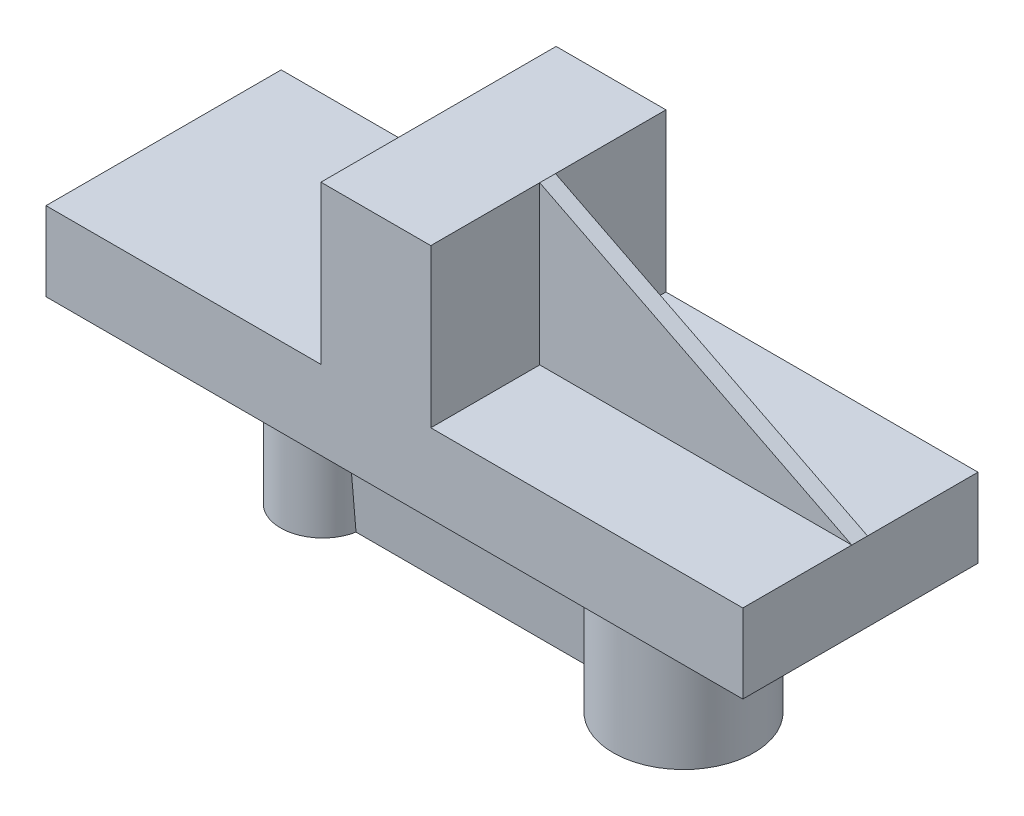
from build123d import *

# Parameters (mm, degrees)
SKETCH1_W           = 88.323262869
SKETCH1_H           = 29.809101218
BOSS_EXTRUDE1_DEPTH = 10
SKETCH2_W           = 13.924014339
SKETCH2_H           = 29.809101218
BOSS_EXTRUDE2_DEPTH = 20
RIB1_REACH          = 96.478
SKETCH4_WALL_W      = 235.275808006
SKETCH4_WALL_H      = 2
SKETCH5_R           = 5.326775894
SKETCH5_R_2         = 8.926735981
BOSS_EXTRUDE3_DEPTH = 20
RIB2_REACH          = 96.478
SKETCH6_WALL_W      = 222.44376487
SKETCH6_WALL_H      = 2
RIB2_DRAFT_ANGLE    = 4


with BuildPart() as part:
    # Sketch1 → Boss-Extrude1 (new body)
    with BuildSketch(Plane(origin=(0, 0, 0), x_dir=(1, 0, 0), z_dir=(0, 1, 0))):
        with Locations((44.161631435, -14.904550609)):
            Rectangle(SKETCH1_W, SKETCH1_H)
    extrude(amount=BOSS_EXTRUDE1_DEPTH)

    # Sketch2 → Boss-Extrude2 (add)
    with BuildSketch(Plane(origin=(0, 10, 0), x_dir=(1, 0, 0), z_dir=(0, 1, 0))):
        with Locations((41.809601986, -14.904550609)):
            Rectangle(SKETCH2_W, SKETCH2_H)
    extrude(amount=BOSS_EXTRUDE2_DEPTH)

    # Sketch4 wall → Rib1 (add, up to next)
    with BuildSketch(Plane(origin=(68.547436012, 20, 15), x_dir=(0.892394851297, -0.451255392631, 0), z_dir=(0.451255392631, 0.892394851297, 0)), mode=Mode.PRIVATE) as rib1_sk1:
        Rectangle(SKETCH4_WALL_W, SKETCH4_WALL_H)
    rib1_tool1 = extrude(rib1_sk1.sketch, amount=-RIB1_REACH, mode=Mode.PRIVATE) - part.part
    add(rib1_tool1.solids().sort_by_distance((68.547436012, 20, 15))[0])

    # Sketch5 → Boss-Extrude3 (add)
    with BuildSketch(Plane.XZ):
        with Locations(Location((20.255604114, 15, 0), (0, 0, 90))):
            Circle(SKETCH5_R)
        with Locations(Location((65.99787284, 15, 0), (0, 0, 90))):
            Circle(SKETCH5_R_2)
    extrude(amount=BOSS_EXTRUDE3_DEPTH)

    # Sketch6 wall → Rib2 (add, up to next)
    with BuildSketch(Plane(origin=(41.326758433, -20, 15), x_dir=(1, 0, 0), z_dir=(0, 1, 0)), mode=Mode.PRIVATE) as rib2_sk1:
        Rectangle(SKETCH6_WALL_W, SKETCH6_WALL_H)
    rib2_tool1 = extrude(rib2_sk1.sketch, amount=RIB2_REACH, mode=Mode.PRIVATE) - part.part
    add(rib2_tool1.solids().sort_by_distance((41.326758433, -20, 15))[0])

    # Rib2 draft
    rib2_draft_faces = [part.faces().sort_by_distance(p)[0] for p in [
        (41.326758433, -19.5, 14),
        (41.326758433, -19.5, 16),
    ]]
    draft(rib2_draft_faces, Plane(origin=(41.326758433, -20, 15), x_dir=(1, 0, 0), z_dir=(0, -1, 0)), RIB2_DRAFT_ANGLE)


solid = part.part
